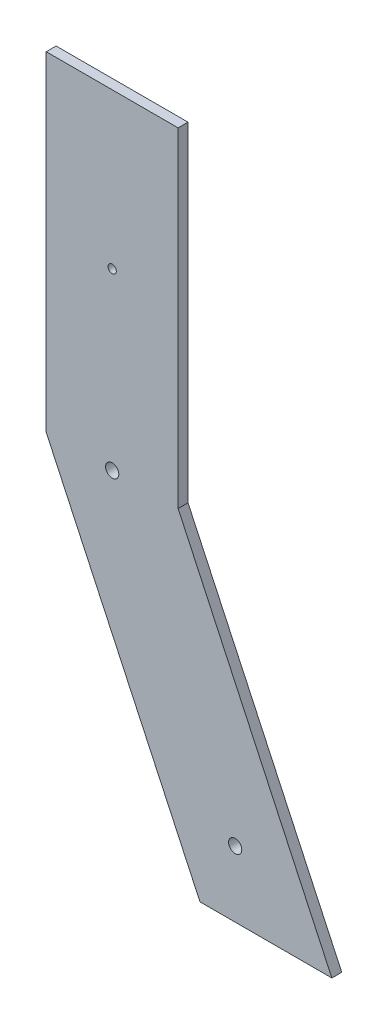
from build123d import *

# Parameters (mm, degrees)
CROQUIS1_R              = 2
CROQUIS1_R_2            = 1.25
SALIENTE_EXTRUIR1_DEPTH = 3


with BuildPart() as part:
    # Croquis1 → Saliente-Extruir1 (new body)
    with BuildSketch(Plane.XY):
        Polygon((0, 0), (-40, 0), (-86.630765816, 100), (-86.630765816, 200), (-46.630765816, 200), (-46.630765816, 100), align=None)
        with Locations((-29.326153163, 20)):
            Circle(CROQUIS1_R, mode=Mode.SUBTRACT)
        with Locations((-66.630765816, 152.96)):
            Circle(CROQUIS1_R_2, mode=Mode.SUBTRACT)
        with Locations((-66.630765816, 100)):
            Circle(CROQUIS1_R, mode=Mode.SUBTRACT)
    extrude(amount=SALIENTE_EXTRUIR1_DEPTH)


solid = part.part
